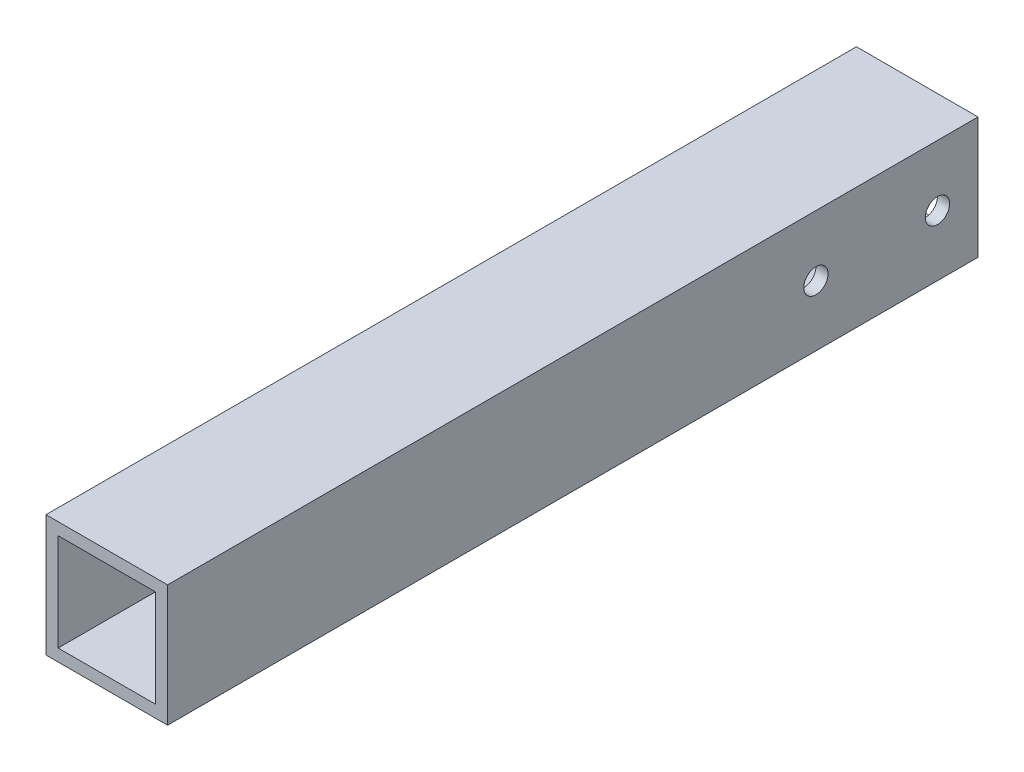
from build123d import *

# Parameters (mm, degrees)
ESQUISSE1_W             = 15
ESQUISSE1_H             = 15
EXTRUSION1_DEPTH        = 100
ESQUISSE2_W             = 12
ESQUISSE2_H             = 12
EXTRUSION2_DEPTH        = 101.560926806
ESQUISSE3_R             = 1.5
ENL_V_MAT_EXTRU_1_DEPTH = 102.396498953
ESQUISSE4_R             = 1.5
ENL_V_MAT_EXTRU_2_DEPTH = 102.396498953


with BuildPart() as part:
    # Esquisse1 → Extrusion1 (new body)
    with BuildSketch(Plane.XY):
        Rectangle(ESQUISSE1_W, ESQUISSE1_H)
    extrude(amount=EXTRUSION1_DEPTH)

    # Esquisse2 → Extrusion2 (cut, through all)
    with BuildSketch(Plane.XY.offset(100)):
        Rectangle(ESQUISSE2_W, ESQUISSE2_H)
    extrude(amount=-EXTRUSION2_DEPTH, mode=Mode.SUBTRACT)

    # Esquisse3 → Enlèv. mat.-Extru.1 (cut, through all)
    with BuildSketch(Plane(origin=(7.5, 0, 0), x_dir=(0, 0, -1), z_dir=(1, 0, 0))):
        with Locations((-5, 0)):
            Circle(ESQUISSE3_R)
    extrude(amount=-ENL_V_MAT_EXTRU_1_DEPTH, mode=Mode.SUBTRACT)

    # Esquisse4 → Enlèv. mat.-Extru.2 (cut, through all)
    with BuildSketch(Plane(origin=(7.5, 0, 0), x_dir=(0, 0, -1), z_dir=(1, 0, 0))):
        with Locations((-20, 0)):
            Circle(ESQUISSE4_R)
    extrude(amount=-ENL_V_MAT_EXTRU_2_DEPTH, mode=Mode.SUBTRACT)


solid = part.part
